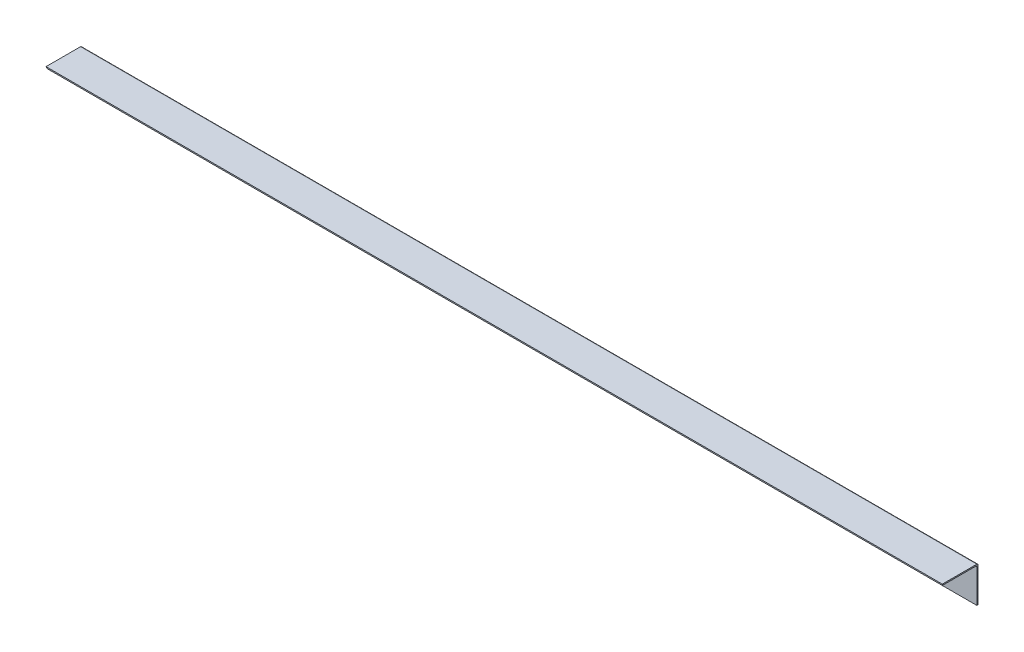
from build123d import *

# Parameters (mm, degrees)
BOSS_EXTRUDE1_DEPTH = 2210
FILLET1_R           = 3
CUT_EXTRUDE2_DEPTH  = 88


with BuildPart() as part:
    # Sketch1 → Boss-Extrude1 (new body)
    with BuildSketch(Plane(origin=(0, 0, 0), x_dir=(0, 0, -1), z_dir=(1, 0, 0))):
        Polygon((0, 0), (88, 0), (88, -88), (85, -88), (85, -3), (0, -3), align=None)
    extrude(amount=BOSS_EXTRUDE1_DEPTH)

    # Fillet1
    fillet1_edges = [part.edges().sort_by_distance(p)[0] for p in [
        (1105, 0, -88),
        (1105, -3, -85),
    ]]
    fillet(fillet1_edges, radius=FILLET1_R)

    # Sketch3 → Cut-Extrude2 (cut)
    with BuildSketch(Plane(origin=(0, 0, -88), x_dir=(-1, 0, 0), z_dir=(0, 0, -1))):
        Polygon((0, 0), (-88, -88), (0, -88), align=None)
    extrude(amount=-CUT_EXTRUDE2_DEPTH, mode=Mode.SUBTRACT)


solid = part.part
